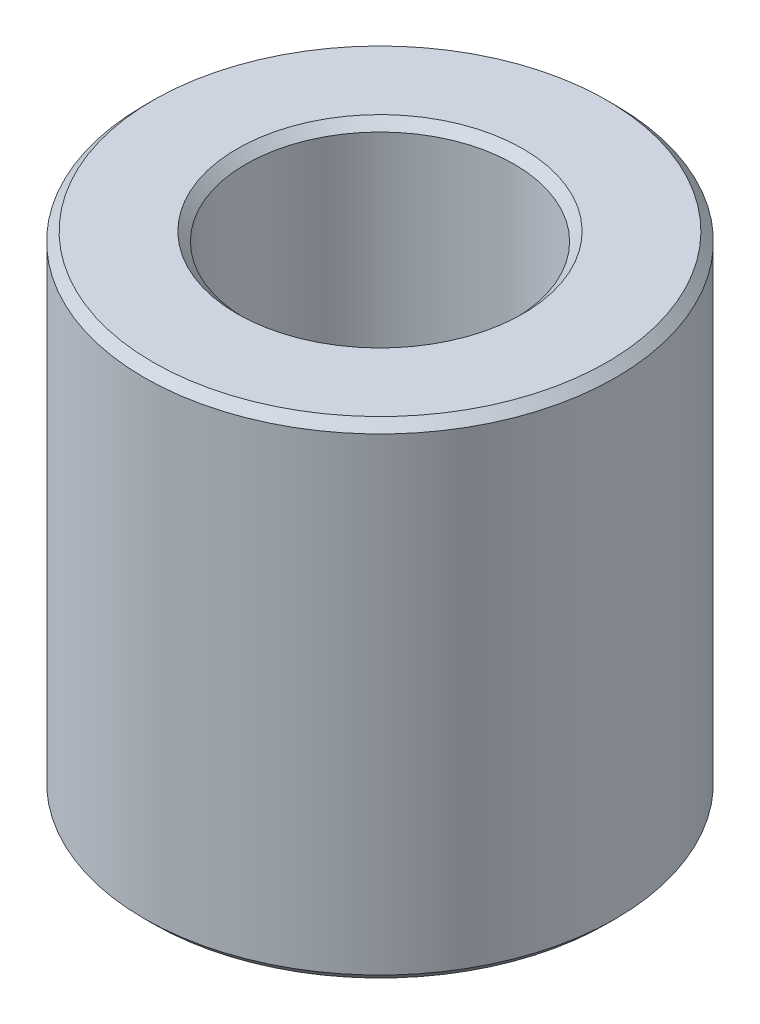
from build123d import *

# Parameters (mm, degrees)
ESQUISSE1_R        = 8
ESQUISSE1_R_2      = 4.55
BOSS_EXTRU_1_DEPTH = 16.5
CHANFREIN1_SIZE    = 0.3


with BuildPart() as part:
    # Esquisse1 → Boss.-Extru.1 (new body)
    with BuildSketch(Plane(origin=(0, 0, 0), x_dir=(1, 0, 0), z_dir=(0, 1, 0))):
        with Locations(Location((0, 0, 0), (0, 0, 270))):
            Circle(ESQUISSE1_R)
        with Locations(Location((0, 0, 0), (0, 0, 270))):
            Circle(ESQUISSE1_R_2, mode=Mode.SUBTRACT)
    extrude(amount=BOSS_EXTRU_1_DEPTH)

    # Chanfrein1
    chanfrein1_edges = [part.edges().sort_by_distance(p)[0] for p in [
        (0, 0, -8),
        (0, 16.5, -8),
        (0, 0, -4.55),
        (0, 16.5, -4.55),
    ]]
    chamfer(chanfrein1_edges, length=CHANFREIN1_SIZE)


solid = part.part
